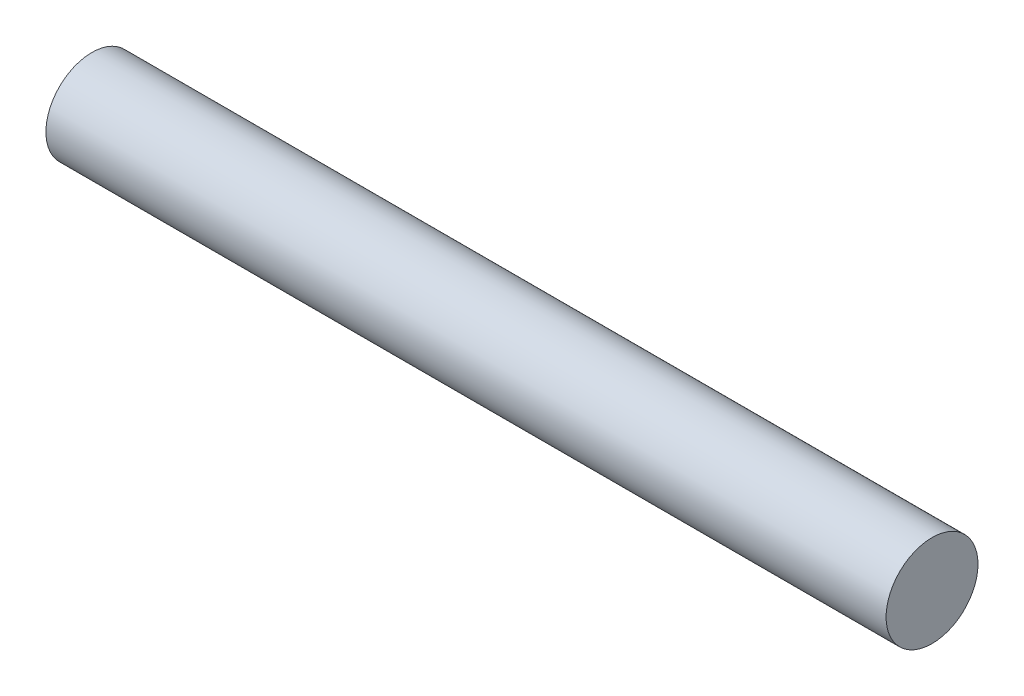
from build123d import *

# Parameters (mm, degrees)
SWEEP1_PROFILE_R   = 11.1125
SKETCH18_R         = 3.175
CUT_EXTRUDE1_DEPTH = 204.806808798


with BuildPart() as part:
    # Sweep1: sweep along a path in Sketch1
    with BuildLine(Plane.XY) as sweep1_path:
        Line((0, 0), (203.2, 0))
    # Sweep1 profile (on start of the path) → Sweep1 (sweep)
    with BuildSketch(Plane(origin=(0, 0, 0), x_dir=(0, 0, 1), z_dir=(1, 0, 0))):
        Circle(SWEEP1_PROFILE_R)
    sweep(path=sweep1_path.line)

    # Sketch18 → Cut-Extrude1 (cut, through all)
    with BuildSketch(Plane.XY):
        with Locations((44.45, 0)):
            Circle(SKETCH18_R)
    extrude(amount=-CUT_EXTRUDE1_DEPTH, mode=Mode.SUBTRACT)


solid = part.part
